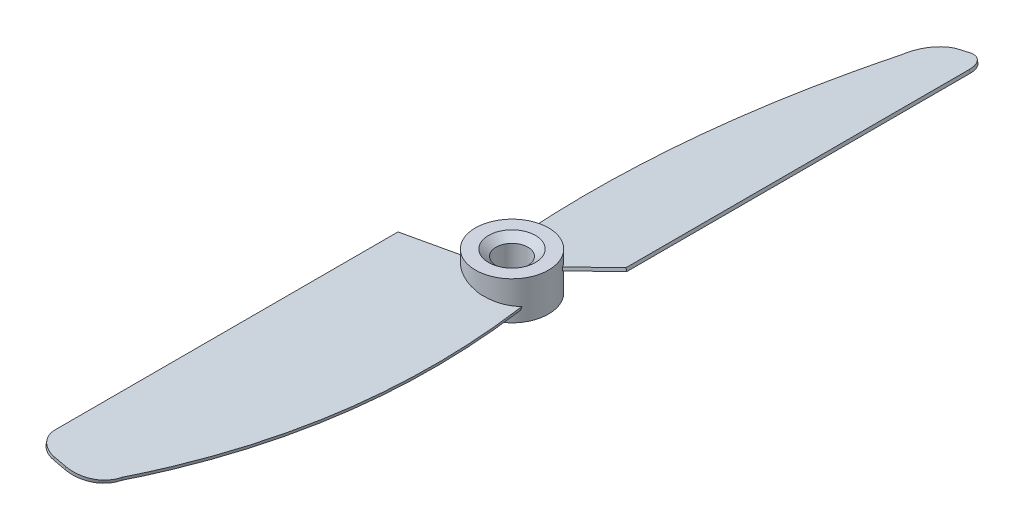
from build123d import *
from OCP.BRepFilletAPI import BRepFilletAPI_MakeChamfer

# Parameters (mm, degrees)
SKETCH1_R           = 5.75
BOSS_EXTRUDE1_DEPTH = 3
BOSS_EXTRUDE2_DEPTH = 0.25
CIRPATTERN2_COUNT   = 2
SKETCH5_R           = 2.5
CUT_EXTRUDE2_DEPTH  = 65.81337733
CHAMFER1_SIZE       = 1
CHAMFER1_SIZE2      = 1.191753593
CIRPATTERN1_COUNT   = 2


with BuildPart() as part:
    # Sketch1 → Boss-Extrude1 (new, symmetric)
    with BuildSketch(Plane(origin=(0, 0, 0), x_dir=(1, 0, 0), z_dir=(0, 1, 0))):
        with Locations(Location((0, 0, 0), (0, 0, 270))):
            Circle(SKETCH1_R)
    extrude(amount=BOSS_EXTRUDE1_DEPTH, both=True)

    # Sketch3 → Boss-Extrude2 (add, symmetric)
    with BuildSketch(Plane(origin=(0, 0, 0), x_dir=(0.9743700647852351, -0.22495105434386545, 0), z_dir=(-0.22495105434386545, -0.9743700647852351, 0))):
        with BuildLine():
            Line((-4.217884967, 2.801368956), (-11.756994241, 6.527912594))
            Line((-11.756994241, 6.527912594), (-11.756994241, 60.5))
            ThreePointArc((-11.756994241, 60.5), (-10.878314584, 62.621320344), (-8.756994241, 63.5))
            Line((-8.756994241, 63.5), (-6.892338734, 63.5))
            ThreePointArc((-6.892338734, 63.5), (-3.698351895, 62.346875105), (-1.977591351, 59.419379228))
            add(Edge.make_bspline(
                [(-1.977591351, 59.419379228), (8.598166734, 31.505186927), (4.658441713, 1.76136177)],
                knots=[0, 0, 0, 1, 1, 1], degree=2))
            add(Edge.make_bspline(
                [(-4.217884967, 2.801368956), (1.070543738, 9.225844279), (4.658441713, 1.76136177)],
                knots=[0, 0, 0, 1, 1, 1], degree=2))
        make_face()
    boss_extrude2 = extrude(amount=BOSS_EXTRUDE2_DEPTH, both=True)

    # CirPattern2: Boss-Extrude2 ×2 about axis
    cirpattern2_axis = Axis((0, 3, 0), (0, -1, 0))
    for i in range(1, CIRPATTERN2_COUNT):
        add(boss_extrude2.rotate(cirpattern2_axis, i * 360 / CIRPATTERN2_COUNT))

    # Sketch5 → Cut-Extrude2 (cut, through all)
    with BuildSketch(Plane.XZ.offset(3)):
        with Locations(Location((0, 0, 0), (0, 0, 270))):
            Circle(SKETCH5_R)
    extrude(amount=-CUT_EXTRUDE2_DEPTH, mode=Mode.SUBTRACT)

    # Chamfer1: one chamfer whose edges measure the first distance from different faces: ONE call of the kernel's chamfer builder (chamfer() names one face for all edges)
    chamfer1_edges_1 = [part.edges().sort_by_distance(p)[0] for p in [
        (0, 3, 2.5),
    ]]
    chamfer1_side_1 = [part.faces().sort_by_distance(p)[0] for p in [
        (0, 0, 2.5),
    ]]
    chamfer1_edges_2 = [part.edges().sort_by_distance(p)[0] for p in [
        (0, -3, 2.5),
    ]]
    chamfer1_side_2 = [part.faces().sort_by_distance(p)[0] for p in [
        (0, -3, -5.58736544),
    ]]
    chamfer1 = BRepFilletAPI_MakeChamfer(part.part.solid().wrapped)
    for e in chamfer1_edges_1:
        chamfer1.Add(CHAMFER1_SIZE, CHAMFER1_SIZE2, e.wrapped, chamfer1_side_1[0].wrapped)  # the first distance lies on this face
    for e in chamfer1_edges_2:
        chamfer1.Add(CHAMFER1_SIZE, CHAMFER1_SIZE2, e.wrapped, chamfer1_side_2[0].wrapped)  # the first distance lies on this face
    add(Compound.cast(chamfer1.Shape()), mode=Mode.REPLACE)

    # CirPattern1: Boss-Extrude2 ×2 about axis
    cirpattern1_axis = Axis((0, 3, 0), (0, -1, 0))
    for i in range(1, CIRPATTERN1_COUNT):
        add(boss_extrude2.rotate(cirpattern1_axis, i * 360 / CIRPATTERN1_COUNT))


solid = part.part
